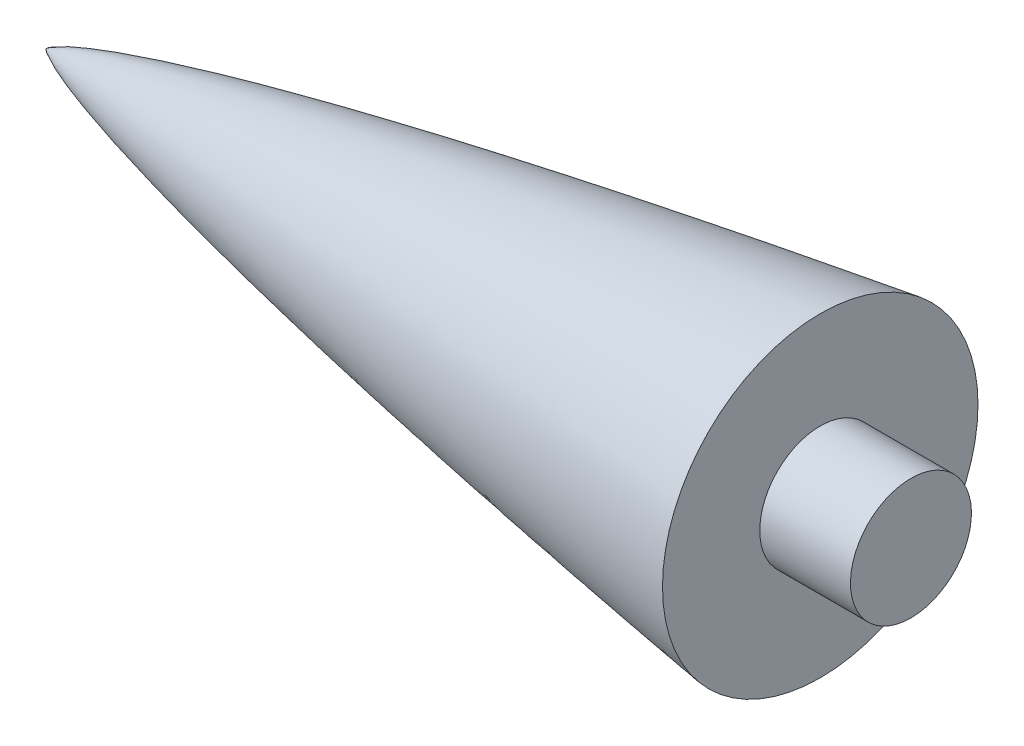
from build123d import *

# Parameters (mm, degrees)
SKETCH8_R           = 83.841254666
BOSS_EXTRUDE1_DEPTH = 10.16
SKETCH9_R           = 117.461252673
CUT_EXTRUDE1_DEPTH  = 681.99
SKETCH10_R          = 12.7
BOSS_EXTRUDE2_DEPTH = 19.05


with BuildPart() as part:
    # Sketch7 → Revolve3 (revolve)
    with BuildSketch(Plane.XY):
        with BuildLine():
            Line((762, 83.841254666), (762, 0))
            Line((762, 0), (0, 0))
            add(Edge.make_bspline(
                [(0, 0), (0.002469036, 0.007698152), (0.00852038, 0.022545642), (0.025428785, 0.049911406), (0.065694849, 0.100096678), (0.127523873, 0.163176144), (0.212062429, 0.237272493), (0.332279694, 0.331578396), (0.47681638, 0.434147846), (0.646496772, 0.544815952), (0.841412681, 0.663024364), (1.126864222, 0.82633392), (1.572744504, 1.062892156), (2.33539055, 1.432268664), (3.710931738, 2.02979685), (6.154578127, 2.969838304), (10.668005752, 4.490267325), (18.999517068, 6.917303838), (33.385795617, 10.520869917), (58.214680344, 15.881727226), (92.501407111, 22.236378549), (134.347160824, 29.066892837), (181.232321928, 35.913847395), (228.199436648, 42.167572329), (275.229416109, 47.928683924), (322.309575865, 53.261898342), (369.432294544, 58.204857708), (416.591925172, 62.781349507), (463.784734462, 67.002125548), (511.007900045, 70.868414522), (558.259527802, 74.370378395), (605.538293137, 77.485800464), (646.930327879, 79.837294836), (682.425589554, 81.539197971), (710.863439026, 82.65535626), (729.852911101, 83.259007577), (745.309411706, 83.632760833), (754.846503834, 83.785926018), (759.61543609, 83.834878653), (762, 83.841254666)],
                knots=[0, 0, 0, 0, 0, 4.177e-05, 8.3539e-05, 0.000167079, 0.000334158, 0.000501236, 0.000668315, 0.000962463, 0.001256611, 0.001555846, 0.001855081, 0.002674694, 0.003884179, 0.005967022, 0.009661666, 0.016303633, 0.028675652, 0.051140007, 0.0868676, 0.148543873, 0.210220157, 0.271896443, 0.333572727, 0.395249011, 0.456925295, 0.518601581, 0.580277867, 0.641954151, 0.703630435, 0.765306721, 0.826983006, 0.888659291, 0.919497433, 0.950335576, 0.975167788, 0.987583894, 1, 1, 1, 1, 1], degree=4))
        make_face()
    revolve(axis=Axis((0, 0, 0), (1, 0, 0)))

    # Sketch8 → Boss-Extrude1 (add)
    with BuildSketch(Plane(origin=(762, 0, 0), x_dir=(0, 0, -1), z_dir=(1, 0, 0))):
        with Locations(Location((0, 0, 0), (0, 0, 90))):
            Circle(SKETCH8_R)
    extrude(amount=BOSS_EXTRUDE1_DEPTH)

    # Sketch9 → Cut-Extrude1 (cut)
    with BuildSketch(Plane(origin=(162.56, 0, 0), x_dir=(0, 0, -1), z_dir=(1, 0, 0))):
        Circle(SKETCH9_R)
    extrude(amount=CUT_EXTRUDE1_DEPTH, mode=Mode.SUBTRACT)

    # Sketch10 → Boss-Extrude2 (add)
    with BuildSketch(Plane(origin=(162.56, 0, 0), x_dir=(0, 0, -1), z_dir=(1, 0, 0))):
        with Locations(Location((0, 0, 0), (0, 0, 270))):
            Circle(SKETCH10_R)
    extrude(amount=BOSS_EXTRUDE2_DEPTH)


solid = part.part
